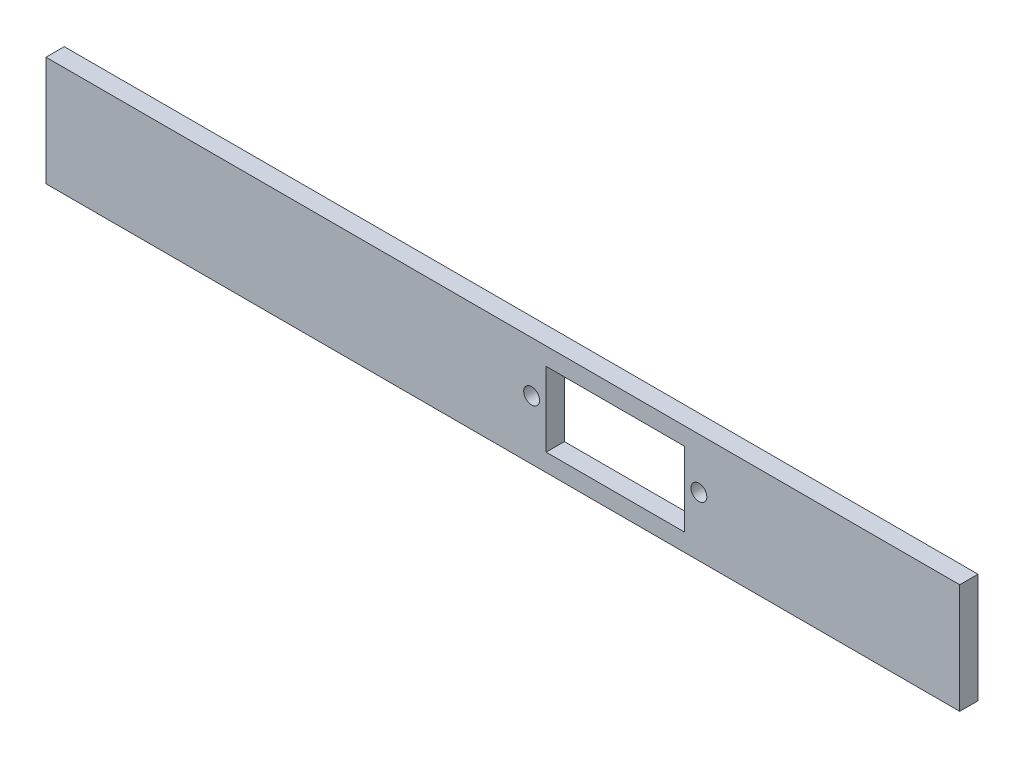
from build123d import *

# Parameters (mm, degrees)
SKETCH1_W           = 150
SKETCH1_H           = 18
BOSS_EXTRUDE1_DEPTH = 3
SKETCH2_W           = 22.7
SKETCH2_H           = 12.2
CUT_EXTRUDE1_DEPTH  = 3
SKETCH3_R           = 1.2
BOSS_EXTRUDE2_DEPTH = 3
SKETCH4_R           = 1.3
CUT_EXTRUDE2_DEPTH  = 3


with BuildPart() as part:
    # Sketch1 → Boss-Extrude1 (new body)
    with BuildSketch(Plane.XY):
        Rectangle(SKETCH1_W, SKETCH1_H)
    extrude(amount=BOSS_EXTRUDE1_DEPTH)

    # Sketch2 → Cut-Extrude1 (cut)
    with BuildSketch(Plane(origin=(0, 0, 0), x_dir=(-1, 0, 0), z_dir=(0, 0, -1))):
        with Locations((-18.45, 0)):
            Rectangle(SKETCH2_W, SKETCH2_H)
    extrude(amount=-CUT_EXTRUDE1_DEPTH, mode=Mode.SUBTRACT)

    # Sketch3 → Boss-Extrude2 (add)
    with BuildSketch(Plane.XY.offset(3)):
        with Locations((32.175, 0.1)):
            Circle(SKETCH3_R)
    extrude(amount=-BOSS_EXTRUDE2_DEPTH)

    # Sketch4 → Cut-Extrude2 (cut)
    with BuildSketch(Plane(origin=(0, 0, 0), x_dir=(-1, 0, 0), z_dir=(0, 0, -1))):
        with Locations((-32.18, 0.723190071)):
            Circle(SKETCH4_R)
        with Locations(Location((-4.72, 0.723190071, 0), (0, 0, 180))):
            Circle(SKETCH4_R)
    extrude(amount=-CUT_EXTRUDE2_DEPTH, mode=Mode.SUBTRACT)


solid = part.part
